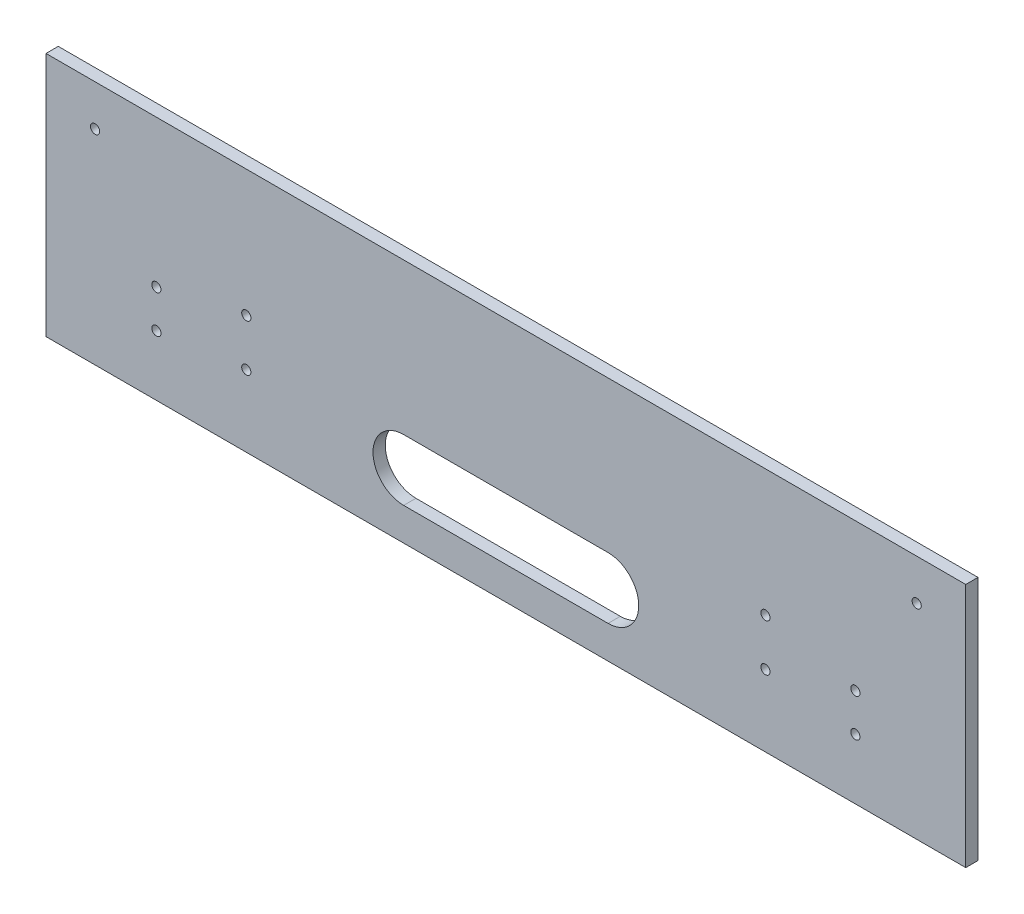
from build123d import *

# Parameters (mm, degrees)
SCHIZZO1_W                   = 450
SCHIZZO1_H                   = 120
ESTRUSIONE_ESTRUSIONE1_DEPTH = 6
TAGLIO_ESTRUSIONE1_DEPTH     = 10
SCHIZZO3_R                   = 2.25
TAGLIO_ESTRUSIONE2_DEPTH     = 10


with BuildPart() as part:
    # Schizzo1 → Estrusione-Estrusione1 (new body)
    with BuildSketch(Plane.XY):
        Rectangle(SCHIZZO1_W, SCHIZZO1_H)
    extrude(amount=ESTRUSIONE_ESTRUSIONE1_DEPTH)

    # Schizzo2 → Taglio-Estrusione1 (cut)
    with BuildSketch(Plane(origin=(0, 0, 0), x_dir=(-1, 0, 0), z_dir=(0, 0, -1))):
        with BuildLine():
            Line((-50, -14), (50, -14))
            ThreePointArc((50, -14), (65, -29), (50, -44))
            Line((50, -44), (-50, -44))
            ThreePointArc((-50, -44), (-65, -29), (-50, -14))
        make_face()
    extrude(amount=-TAGLIO_ESTRUSIONE1_DEPTH, mode=Mode.SUBTRACT)

    # Schizzo3 → Taglio-Estrusione2 (cut)
    with BuildSketch(Plane.XY.offset(6)):
        with Locations((-171, -12)):
            Circle(SCHIZZO3_R)
        with Locations((-171, -30.5)):
            Circle(SCHIZZO3_R)
        with Locations((171, -12)):
            Circle(SCHIZZO3_R)
        with Locations((171, -30.5)):
            Circle(SCHIZZO3_R)
        with Locations((201, 40)):
            Circle(SCHIZZO3_R)
        with Locations((-201, 40)):
            Circle(SCHIZZO3_R)
        with Locations((127, -2)):
            Circle(SCHIZZO3_R)
        with Locations((127, -25)):
            Circle(SCHIZZO3_R)
        with Locations((-127, -2)):
            Circle(SCHIZZO3_R)
        with Locations((-127, -25)):
            Circle(SCHIZZO3_R)
    extrude(amount=-TAGLIO_ESTRUSIONE2_DEPTH, mode=Mode.SUBTRACT)


solid = part.part
